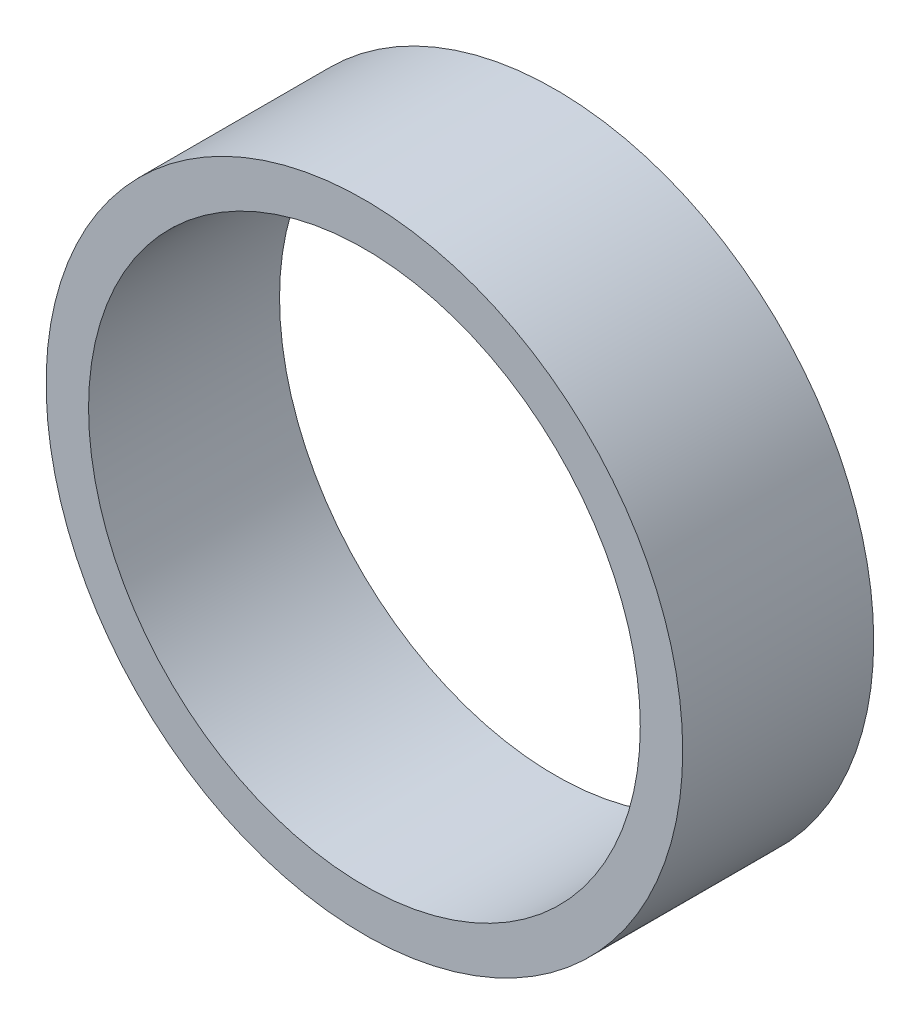
from build123d import *

# Parameters (mm, degrees)
SKETCH1_R           = 38.1
SKETCH1_R_2         = 33.02
BOSS_EXTRUDE1_DEPTH = 22.86


with BuildPart() as part:
    # Sketch1 → Boss-Extrude1 (new body)
    with BuildSketch(Plane.XY):
        Circle(SKETCH1_R)
        Circle(SKETCH1_R_2, mode=Mode.SUBTRACT)
    extrude(amount=BOSS_EXTRUDE1_DEPTH)


solid = part.part
